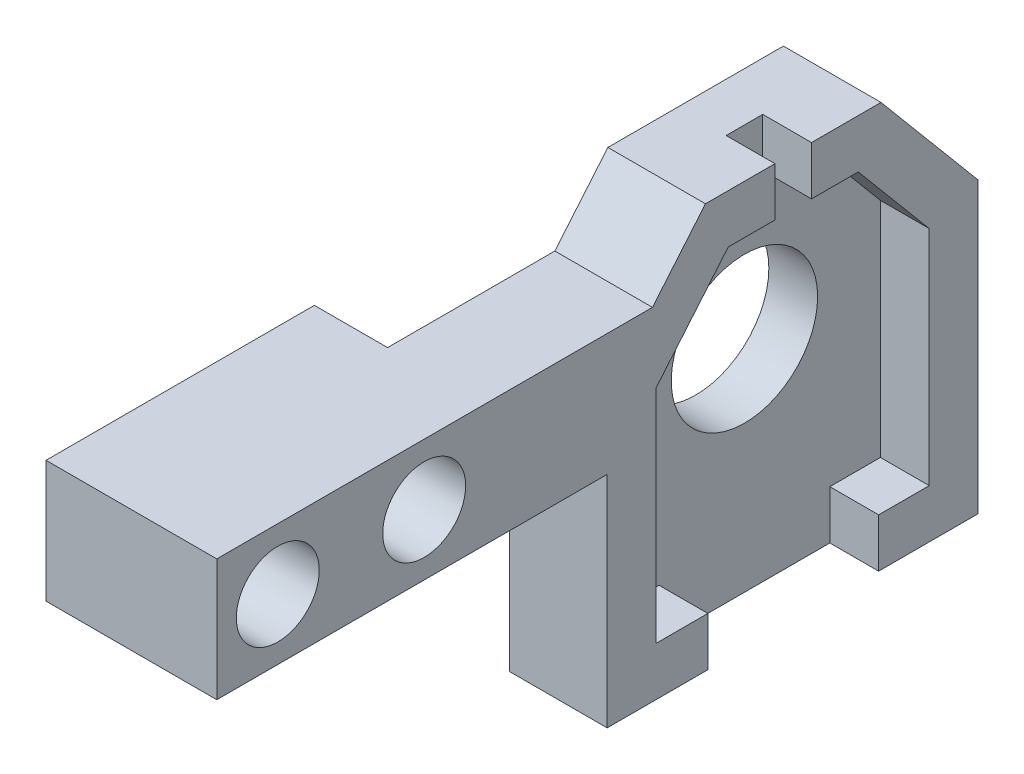
from build123d import *

# Parameters (mm, degrees)
BOSS_EXTRUDE1_DEPTH = 2
BOSS_EXTRUDE2_DEPTH = 2
SKETCH3_R           = 3
CUT_EXTRUDE1_DEPTH  = 2
SKETCH4_R           = 1.7
BOSS_EXTRUDE3_DEPTH = 7
CUT_EXTRUDE2_DEPTH  = 3


with BuildPart() as part:
    # Sketch2 → Boss-Extrude1 (new body)
    with BuildSketch(Plane(origin=(0, 0, 0), x_dir=(0, 0, -1), z_dir=(1, 0, 0))):
        Polygon((-8.109308511, -7.091340238), (-8.109308511, 4.696600231), (-4.079902129, 9.498659762), (3.11566899, 9.498659762), (7.090691489, 4.761412419), (7.090691489, -7.091340238), align=None)
    extrude(amount=-BOSS_EXTRUDE1_DEPTH)

    # Sketch1 → Boss-Extrude2 (add)
    with BuildSketch(Plane(origin=(0, 0, 0), x_dir=(0, 0, -1), z_dir=(1, 0, 0))):
        Polygon((-6.109308511, 3.968659762), (-3.147286813, 7.498659762), (-1.232116569, 7.498659762), (-1.232116569, 9.498659762), (-4.079902129, 9.498659762), (-8.109308511, 4.696600231), (-8.109308511, -7.091340238), (-3.982116569, -7.091340238), (-3.982116569, -5.091340238), (-6.109308511, -5.091340238), align=None)
        Polygon((5.090691489, 4.03347195), (5.090691489, -5.091340238), (3.017883431, -5.091340238), (3.017883431, -7.091340238), (7.090691489, -7.091340238), (7.090691489, 4.761412419), (3.11566899, 9.498659762), (0.267883431, 9.498659762), (0.267883431, 7.498659762), (2.183053674, 7.498659762), align=None)
    extrude(amount=BOSS_EXTRUDE2_DEPTH)

    # Sketch3 → Cut-Extrude1 (cut)
    with BuildSketch(Plane(origin=(0, 0, 0), x_dir=(0, 0, -1), z_dir=(1, 0, 0))):
        with Locations((-0.482116569, 1.908659762)):
            Circle(SKETCH3_R)
    extrude(amount=-CUT_EXTRUDE1_DEPTH, mode=Mode.SUBTRACT)

    # Sketch4 → Boss-Extrude3 (add)
    with BuildSketch(Plane(origin=(2, 0, 0), x_dir=(0, 0, -1), z_dir=(1, 0, 0))):
        Polygon((-15.482116569, 1.908659762), (-8.109308511, 1.908659762), (-8.109308511, 4.696600231), (-6.253170174, 6.908659762), (-20.486049047, 6.908659762), (-24.109308511, 6.908659762), (-24.109308511, 1.908659762), align=None)
        with Locations((-15.609308511, 4.408659762)):
            Circle(SKETCH4_R, mode=Mode.SUBTRACT)
        with Locations((-21.609308511, 4.408659762)):
            Circle(SKETCH4_R, mode=Mode.SUBTRACT)
    extrude(amount=-BOSS_EXTRUDE3_DEPTH)

    # Sketch5 → Cut-Extrude2 (cut)
    with BuildSketch(Plane.ZY.offset(5)):
        Polygon((8.109308511, 6.908659762), (6.253170174, 6.908659762), (8.109308511, 4.696600231), (8.109308511, 1.908659762), (13.109308511, 1.908659762), (13.109308511, 6.908659762), align=None)
    extrude(amount=-CUT_EXTRUDE2_DEPTH, mode=Mode.SUBTRACT)


solid = part.part
